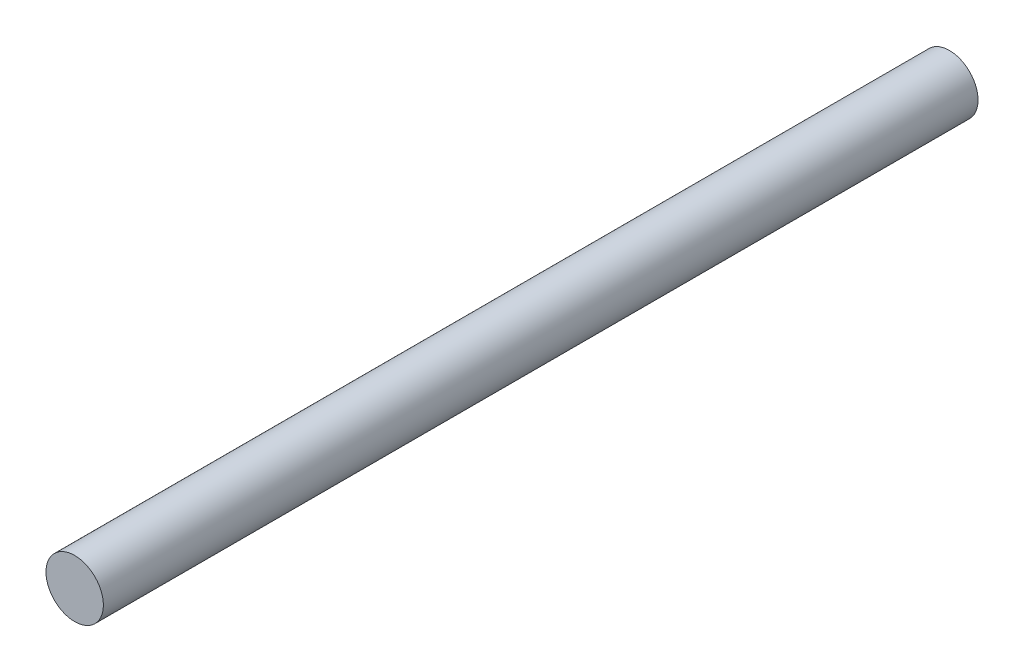
from build123d import *

# Parameters (mm, degrees)
SKETCH1_R           = 2
BOSS_EXTRUDE1_DEPTH = 30.5


with BuildPart() as part:
    # Sketch1 → Boss-Extrude1 (new, symmetric)
    with BuildSketch(Plane.XY):
        with Locations(Location((0, 0, 0), (0, 0, 180))):
            Circle(SKETCH1_R)
    extrude(amount=BOSS_EXTRUDE1_DEPTH, both=True)


solid = part.part
